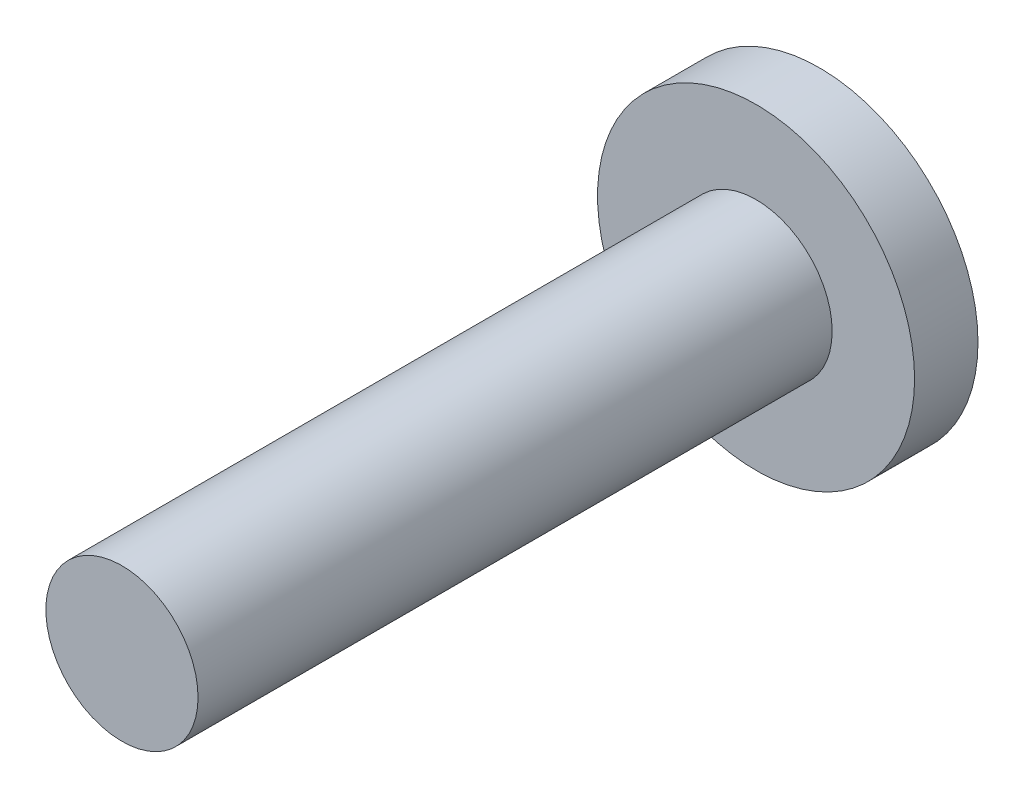
from build123d import *

# Parameters (mm, degrees)
SKETCH_1_R          = 6.25
EXTRUDE_1_DEPTH     = 2.5
SKETCH_2_R          = 3
EXTRUDE_2_DEPTH     = 25
CUT_EXTRUDE_1_DEPTH = 1


with BuildPart() as part:
    # 草图1 → 凸台-拉伸1 (new body)
    with BuildSketch(Plane.XY):
        Circle(SKETCH_1_R)
    extrude(amount=EXTRUDE_1_DEPTH)

    # 草图2 → 凸台-拉伸2 (add)
    with BuildSketch(Plane.XY.offset(2.5)):
        Circle(SKETCH_2_R)
    extrude(amount=EXTRUDE_2_DEPTH)

    # 草图3 → 切除-拉伸1 (cut)
    with BuildSketch(Plane(origin=(0, 0, 0), x_dir=(-1, 0, 0), z_dir=(0, 0, -1))):
        Polygon((2.309401077, 0), (1.154700538, 2), (-1.154700538, 2), (-2.309401077, 0), (-1.154700538, -2), (1.154700538, -2), align=None)
    extrude(amount=-CUT_EXTRUDE_1_DEPTH, mode=Mode.SUBTRACT)


solid = part.part
